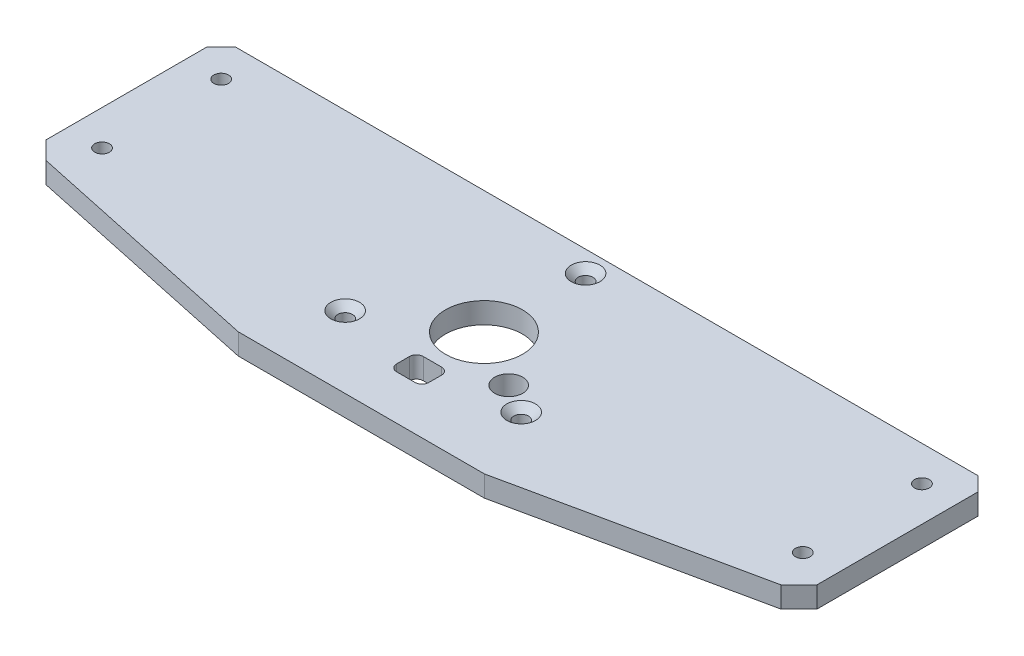
from build123d import *
from OCP.BRepFilletAPI import BRepFilletAPI_MakeChamfer

# Parameters (mm, degrees)
SKETCH_1_W          = 220
SKETCH_1_H          = 70
SKETCH_1_R          = 2.1
SKETCH_1_R_2        = 11
EXTRUDE_1_DEPTH     = 3
SKETCH_2_R          = 4
CUT_EXTRUDE_1_DEPTH = 116.589791937
CUT_EXTRUDE_2_DEPTH = 116.589791937
CHAMFER_1_SIZE      = 2
CUT_EXTRUDE_3_DEPTH = 116.589791937
CHAMFER_3_SIZE      = 4
CHAMFER_3_SIZE2     = 5.201672953


with BuildPart() as part:
    # 草图1 → 凸台-拉伸1 (new, symmetric)
    with BuildSketch(Plane(origin=(0, 0, 0), x_dir=(1, 0, 0), z_dir=(0, 1, 0))):
        Rectangle(SKETCH_1_W, SKETCH_1_H)
        with Locations(Location((-100, 25, 0), (0, 0, 270))):
            Circle(SKETCH_1_R, mode=Mode.SUBTRACT)
        with Locations(Location((100, 25, 0), (0, 0, 270))):
            Circle(SKETCH_1_R, mode=Mode.SUBTRACT)
        with Locations(Location((0, 29, 0), (0, 0, 270))):
            Circle(SKETCH_1_R, mode=Mode.SUBTRACT)
        with Locations(Location((25.11473671, -14.5, 0), (0, 0, 270))):
            Circle(SKETCH_1_R, mode=Mode.SUBTRACT)
        with Locations(Location((-25.11473671, -14.5, 0), (0, 0, 270))):
            Circle(SKETCH_1_R, mode=Mode.SUBTRACT)
        with Locations(Location((0, 0, 0), (0, 0, 270))):
            Circle(SKETCH_1_R_2, mode=Mode.SUBTRACT)
        with Locations(Location((-100, -9, 0), (0, 0, 270))):
            Circle(SKETCH_1_R, mode=Mode.SUBTRACT)
        with Locations(Location((100, -9, 0), (0, 0, 270))):
            Circle(SKETCH_1_R, mode=Mode.SUBTRACT)
    extrude(amount=EXTRUDE_1_DEPTH, both=True)

    # 草图2 → 切除-拉伸1 (cut, through all)
    with BuildSketch(Plane(origin=(0, 3, 0), x_dir=(1, 0, 0), z_dir=(0, 1, 0))):
        with Locations(Location((16.670989023, -9.625, 0), (0, 0, 270))):
            Circle(SKETCH_2_R)
    extrude(amount=-CUT_EXTRUDE_1_DEPTH, mode=Mode.SUBTRACT)

    # 草图3 → 切除-拉伸2 (cut, through all)
    with BuildSketch(Plane(origin=(0, 3, 0), x_dir=(1, 0, 0), z_dir=(0, 1, 0))):
        with BuildLine():
            Line((4.6, -20.3), (4.6, -16.7))
            ThreePointArc((4.6, -16.7), (4.014213562, -15.285786438), (2.6, -14.7))
            Line((2.6, -14.7), (-2.6, -14.7))
            ThreePointArc((-2.6, -14.7), (-4.014213562, -15.285786438), (-4.6, -16.7))
            Line((-4.6, -16.7), (-4.6, -20.3))
            ThreePointArc((-4.6, -20.3), (-4.014213562, -21.714213562), (-2.6, -22.3))
            Line((-2.6, -22.3), (2.6, -22.3))
            ThreePointArc((2.6, -22.3), (4.014213562, -21.714213562), (4.6, -20.3))
        make_face()
    extrude(amount=-CUT_EXTRUDE_2_DEPTH, mode=Mode.SUBTRACT)

    # 倒角1
    chamfer_1_edges = [part.edges().sort_by_distance(p)[0] for p in [
        (0, 3, -31.1),
        (25.11473671, 3, 12.4),
        (-25.11473671, 3, 12.4),
    ]]
    chamfer(chamfer_1_edges, length=CHAMFER_1_SIZE)

    # 草图5 → 切除-拉伸3 (cut, through all)
    with BuildSketch(Plane(origin=(0, 3, 0), x_dir=(1, 0, 0), z_dir=(0, 1, 0))):
        Polygon((-110, -19), (-35.11473671, -35), (-110, -35), align=None)
        Polygon((35.11473671, -35), (110, -35), (110, -19), align=None)
    extrude(amount=-CUT_EXTRUDE_3_DEPTH, mode=Mode.SUBTRACT)

    # 倒角3: one chamfer whose edges measure the first distance from different faces: ONE call of the kernel's chamfer builder (chamfer() names one face for all edges)
    chamfer_3_edges_1 = [part.edges().sort_by_distance(p)[0] for p in [
        (110, 0, 19),
    ]]
    chamfer_3_side_1 = [part.faces().sort_by_distance(p)[0] for p in [
        (110, 0, -8),
    ]]
    chamfer_3_edges_2 = [part.edges().sort_by_distance(p)[0] for p in [
        (-110, 0, -35),
        (110, 0, -35),
    ]]
    chamfer_3_edges_3 = [part.edges().sort_by_distance(p)[0] for p in [
        (-110, 0, 19),
    ]]
    chamfer_3_side_3 = [part.faces().sort_by_distance(p)[0] for p in [
        (-110, 0, -8),
    ]]
    chamfer_3 = BRepFilletAPI_MakeChamfer(part.part.solid().wrapped)
    for e in chamfer_3_edges_1:
        chamfer_3.Add(CHAMFER_3_SIZE, CHAMFER_3_SIZE2, e.wrapped, chamfer_3_side_1[0].wrapped)  # the first distance lies on this face
    for e in chamfer_3_edges_2:
        chamfer_3.Add(CHAMFER_3_SIZE, e.wrapped)
    for e in chamfer_3_edges_3:
        chamfer_3.Add(CHAMFER_3_SIZE, CHAMFER_3_SIZE2, e.wrapped, chamfer_3_side_3[0].wrapped)  # the first distance lies on this face
    add(Compound.cast(chamfer_3.Shape()), mode=Mode.REPLACE)


solid = part.part
